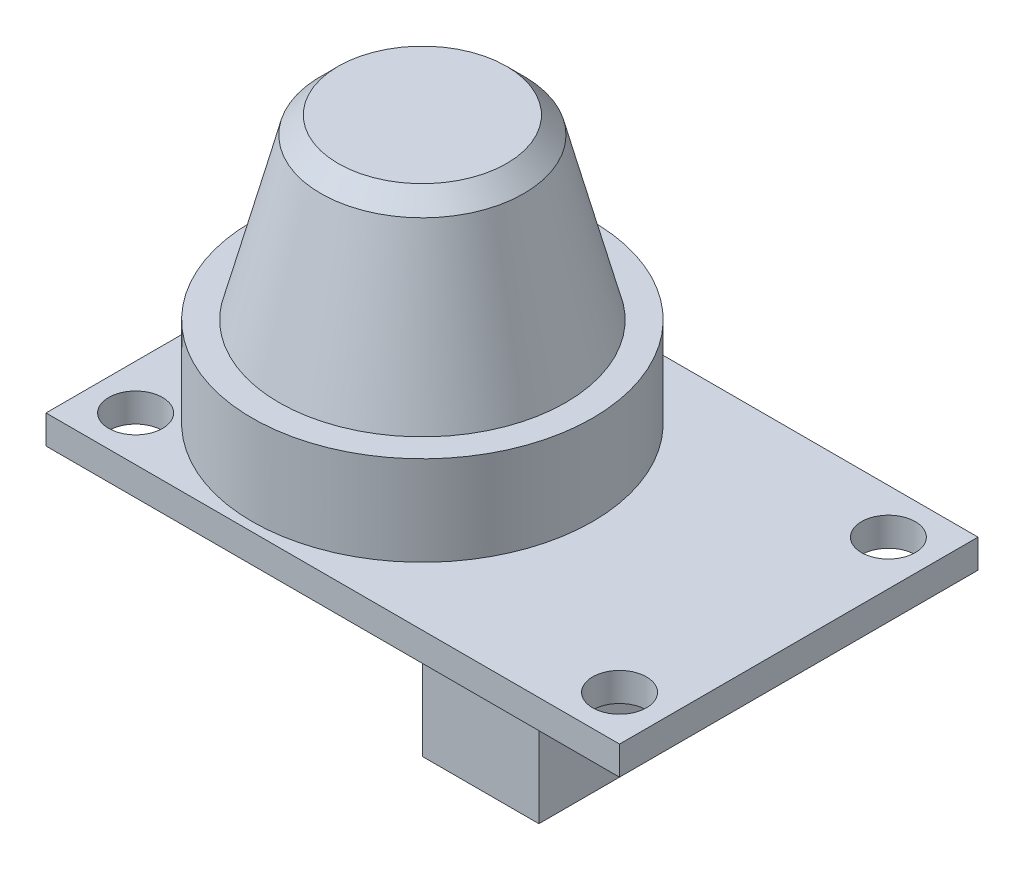
from build123d import *

# Parameters (mm, degrees)
SKETCH_1_W      = 32
SKETCH_1_H      = 20
SKETCH_1_R      = 1.5
EXTRUDE_1_DEPTH = 1.6
SKETCH_2_W      = 6.5
SKETCH_2_H      = 6.5
EXTRUDE_2_DEPTH = 5
SKETCH_3_R      = 9.5
EXTRUDE_3_DEPTH = 16.5


with BuildPart() as part:
    # 草图1 → 凸台-拉伸1 (new body)
    with BuildSketch(Plane(origin=(0, 0, 0), x_dir=(1, 0, 0), z_dir=(0, 1, 0))):
        Rectangle(SKETCH_1_W, SKETCH_1_H)
        with Locations(Location((-13.5, 7.5, 0), (0, 0, 270))):
            Circle(SKETCH_1_R, mode=Mode.SUBTRACT)
        with Locations(Location((13.5, 7.5, 0), (0, 0, 270))):
            Circle(SKETCH_1_R, mode=Mode.SUBTRACT)
        with Locations(Location((-13.5, -7.5, 0), (0, 0, 270))):
            Circle(SKETCH_1_R, mode=Mode.SUBTRACT)
        with Locations(Location((13.5, -7.5, 0), (0, 0, 270))):
            Circle(SKETCH_1_R, mode=Mode.SUBTRACT)
    extrude(amount=EXTRUDE_1_DEPTH)

    # 草图2 → 凸台-拉伸2 (add)
    with BuildSketch(Plane(origin=(0, 0, 0), x_dir=(1, 0, 0), z_dir=(0, 1, 0))):
        with Locations((7.75, -6.25)):
            Rectangle(SKETCH_2_W, SKETCH_2_H)
    extrude(amount=-EXTRUDE_2_DEPTH)

    # 草图3 → 凸台-拉伸3 (add)
    with BuildSketch(Plane(origin=(0, 0, 0), x_dir=(1, 0, 0), z_dir=(0, 1, 0))):
        with Locations(Location((-5, 0, 0), (0, 0, 270))):
            Circle(SKETCH_3_R)
    extrude(amount=EXTRUDE_3_DEPTH)

    # 草图4 → 切除-旋转2 (revolve, cut)
    with BuildSketch(Plane.XY):
        Polygon((-0.3, 16.5), (0.5, 16.5), (4.5, 16.5), (4.5, 6.6), (3, 6.6), (0.666666667, 15.533333333), align=None)
    revolve(axis=Axis((-5, -983.5, 0), (0, 1, 0)), mode=Mode.SUBTRACT)


solid = part.part
